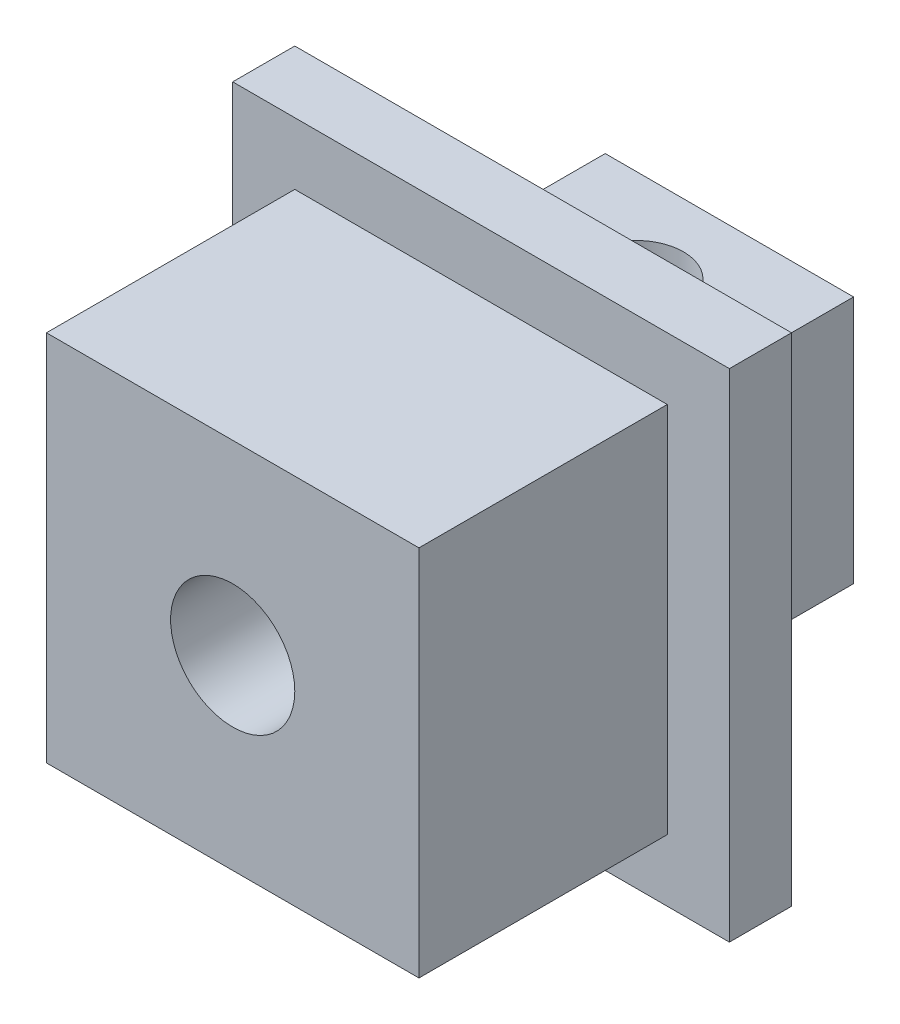
from build123d import *

# Parameters (mm, degrees)
SKETCH2_W           = 19.05
SKETCH2_H           = 19.05
SKETCH2_R           = 3.175
BOSS_EXTRUDE1_DEPTH = 12.7
SKETCH3_W           = 25.4
SKETCH3_H           = 25.4
BOSS_EXTRUDE2_DEPTH = 3.175
SKETCH4_W           = 12.7
SKETCH4_H           = 12.7
BOSS_EXTRUDE3_DEPTH = 9.525
SKETCH5_R           = 3.175
CUT_EXTRUDE1_DEPTH  = 41.411152545
SKETCH6_R           = 2.413
CUT_EXTRUDE2_DEPTH  = 6.35


with BuildPart() as part:
    # Sketch2 → Boss-Extrude1 (new body)
    with BuildSketch(Plane.XY):
        with Locations((9.525, 9.525)):
            Rectangle(SKETCH2_W, SKETCH2_H)
        with Locations((9.525, 9.525)):
            Circle(SKETCH2_R, mode=Mode.SUBTRACT)
    extrude(amount=BOSS_EXTRUDE1_DEPTH)

    # Sketch3 → Boss-Extrude2 (add)
    with BuildSketch(Plane(origin=(0, 0, 0), x_dir=(-1, 0, 0), z_dir=(0, 0, -1))):
        with Locations((-9.525, 9.525)):
            Rectangle(SKETCH3_W, SKETCH3_H)
    extrude(amount=BOSS_EXTRUDE2_DEPTH)

    # Sketch4 → Boss-Extrude3 (add)
    with BuildSketch(Plane(origin=(0, 0, -3.175), x_dir=(-1, 0, 0), z_dir=(0, 0, -1))):
        with Locations((-9.525, 9.525)):
            Rectangle(SKETCH4_W, SKETCH4_H)
    extrude(amount=BOSS_EXTRUDE3_DEPTH)

    # Sketch5 → Cut-Extrude1 (cut, through all)
    with BuildSketch(Plane.XY.offset(12.7)):
        with Locations((9.525, 9.525)):
            Circle(SKETCH5_R)
    extrude(amount=-CUT_EXTRUDE1_DEPTH, mode=Mode.SUBTRACT)

    # Sketch6 → Cut-Extrude2 (cut)
    with BuildSketch(Plane(origin=(0, 15.875, 0), x_dir=(1, 0, 0), z_dir=(0, 1, 0))):
        with Locations(Location((9.525, 7.9375, 0), (0, 0, 180))):
            Circle(SKETCH6_R)
    extrude(amount=-CUT_EXTRUDE2_DEPTH, mode=Mode.SUBTRACT)


solid = part.part
